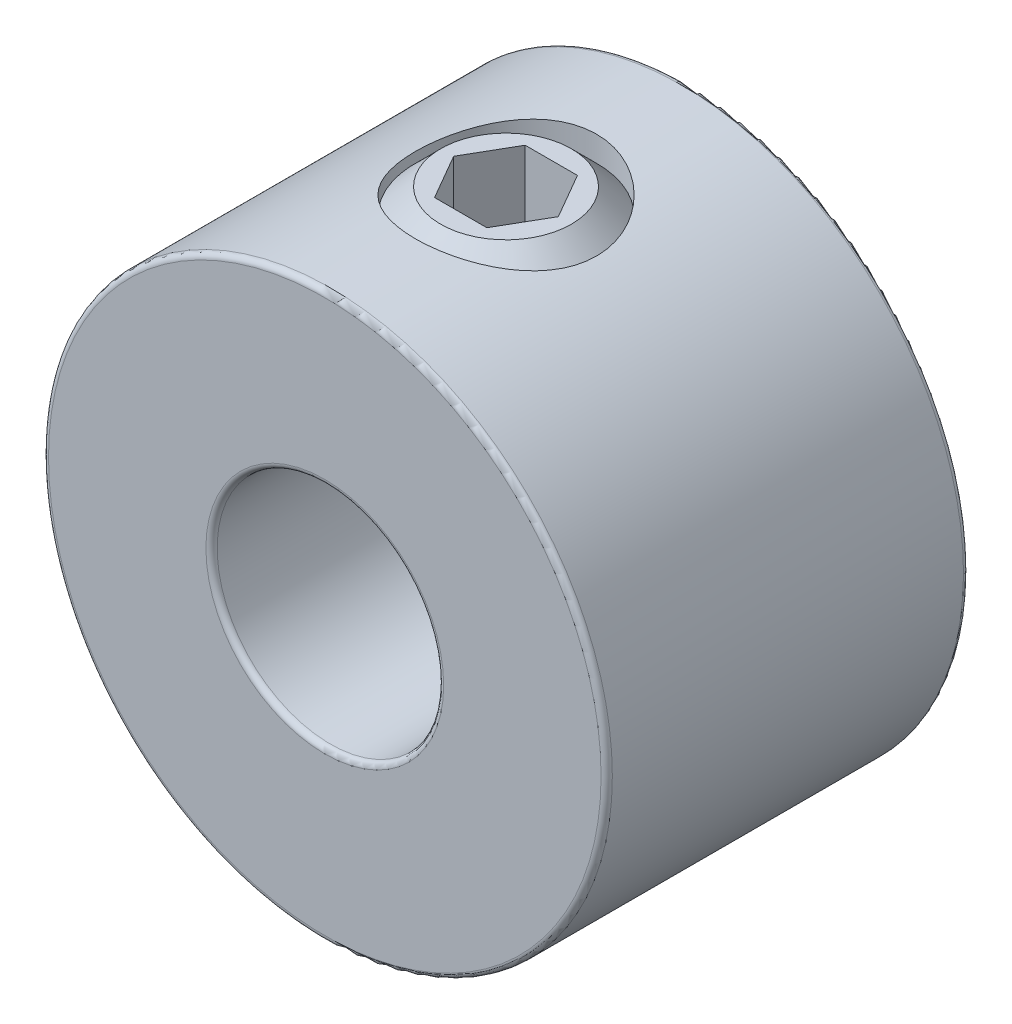
from build123d import *

# Parameters (mm, degrees)
SKETCH1_R               = 6.223
SKETCH1_R_2             = 2.5
EXTRUDE1_DEPTH          = 8
CUT_EXTRUDE1_REACH      = 18.051
CUT_EXTRUDE1_END_RADIUS = 2.5
SKETCH2_R               = 2
CUT_EXTRUDE2_DEPTH      = 1.6
FILLET1_R               = 0.12446


with BuildPart() as part:
    # Sketch1 → Extrude1 (new body)
    with BuildSketch(Plane.XY):
        Circle(SKETCH1_R)
        Circle(SKETCH1_R_2, mode=Mode.SUBTRACT)
    extrude(amount=EXTRUDE1_DEPTH)

    # Cut-Extrude1: up to this cylinder (the profile starts outside it)
    cut_extrude1_end = Plane(origin=(0, 0, 4), z_dir=(0, 0, -1)) * Cylinder(CUT_EXTRUDE1_END_RADIUS, 42.102, mode=Mode.PRIVATE)
    # Sketch2 → Cut-Extrude1 (cut, up to the surface)
    with BuildSketch(Plane(origin=(0, 6.223, 0), x_dir=(-1, 0, 0), z_dir=(0, 1, 0)), mode=Mode.PRIVATE) as cut_extrude1_sk1:
        with Locations(Location((0, 4, 0), (0, 0, 90))):
            Circle(SKETCH2_R)
    cut_extrude1_tool1 = extrude(cut_extrude1_sk1.sketch, amount=-CUT_EXTRUDE1_REACH, mode=Mode.PRIVATE) - cut_extrude1_end
    add(cut_extrude1_tool1.solids().sort_by_distance((0, 6.223, 4))[0], mode=Mode.SUBTRACT)

    # Fillet1
    fillet1_edges = [part.edges().sort_by_distance(p)[0] for p in [
        (-6.223, 0, 0),
        (-6.223, 0, 8),
        (-2.5, 0, 0),
        (-2.5, 0, 8),
    ]]
    fillet(fillet1_edges, radius=FILLET1_R)


with BuildPart() as body_2:
    # Sketch3 → Revolve1 (revolve)
    with BuildSketch(Plane.XY.offset(4), mode=Mode.PRIVATE) as revolve1_sk:
        Polygon((-1.443375673, 6.223), (-2, 5.666375673), (-2, 2.779624327), (-1.443375673, 2.223), (-0.5, 2.223), (0, 3.089025404), (0, 6.223), align=None)
    revolve(revolve1_sk.sketch.rotate(Axis((0, 3.089025404, 4), (0, 1, 0)), 180), axis=Axis((0, 3.089025404, 4), (0, 1, 0)))

    # Sketch4 → Cut-Extrude2 (cut)
    with BuildSketch(Plane(origin=(0, 6.223, 0), x_dir=(0, 0, -1), z_dir=(0, 1, 0))):
        Polygon((-4, 1.154700538), (-5, 0.577350269), (-5, -0.577350269), (-4, -1.154700538), (-3, -0.577350269), (-3, 0.577350269), align=None)
    extrude(amount=-CUT_EXTRUDE2_DEPTH, mode=Mode.SUBTRACT)


solid = Compound([part.part, body_2.part])
